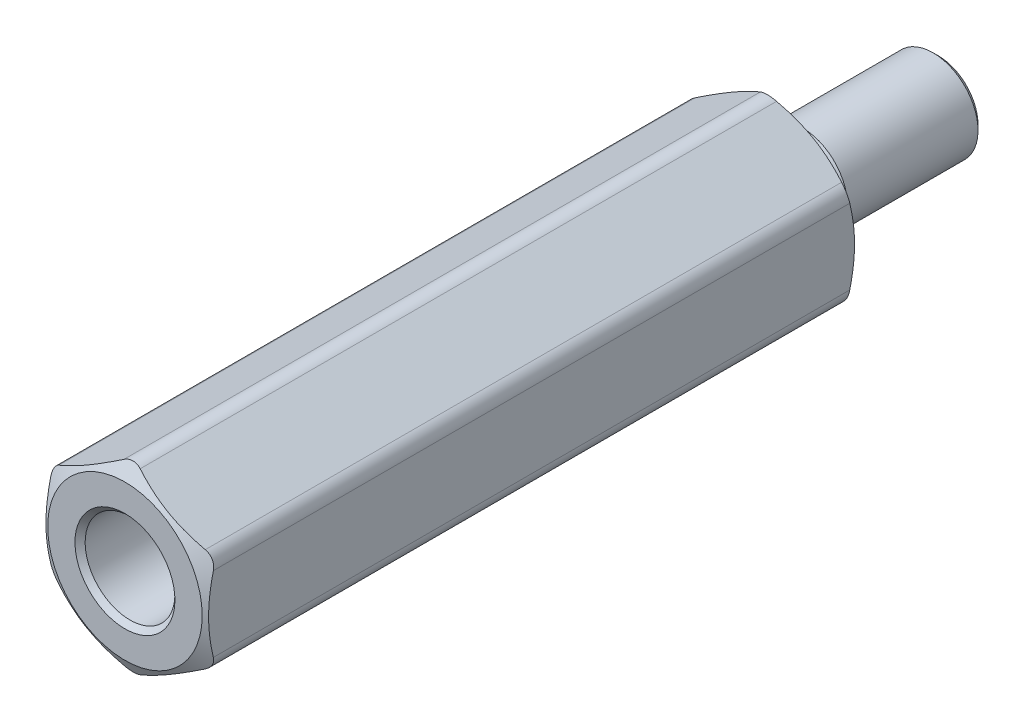
from build123d import *

# Parameters (mm, degrees)
SKETCH4_R           = 2.4638
BOSS_EXTRUDE1_DEPTH = 25.4
SKETCH5_OUTSIDE_W   = 129.714
SKETCH5_OUTSIDE_H   = 130.696
SKETCH5_OUTSIDE_R   = 3.01625
CUT_EXTRUDE1_DEPTH  = 33.11828075
CUT_EXTRUDE1_DRAFT  = -60
SKETCH6_OUTSIDE_W   = 108.032
SKETCH6_OUTSIDE_H   = 109.014
SKETCH6_OUTSIDE_R   = 3.01625
CUT_EXTRUDE2_DEPTH  = 26.858875813
CUT_EXTRUDE2_DRAFT  = -60
FILLET1_R           = 0.635


with BuildPart() as part:
    # Sketch3 → Revolve1 (revolve)
    with BuildSketch(Plane(origin=(0, 0, 0), x_dir=(0, 0, -1), z_dir=(1, 0, 0))):
        with BuildLine():
            Line((-15.875, 1.5541625), (-15.875, 0))
            Line((-15.875, 0), (6.35, 0))
            Line((6.35, 0), (6.35, 1.5541625))
            Line((6.35, 1.5541625), (6.1515625, 1.7526))
            Line((6.1515625, 1.7526), (1.05965625, 1.7526))
            Line((1.05965625, 1.7526), (0.762, 1.237044252))
            Line((0.762, 1.237044252), (0.1984375, 1.237044252))
            ThreePointArc((0.1984375, 1.237044252), (0.058120998, 1.29516525), (0, 1.435481752))
            Line((0, 1.435481752), (0, 3.175))
            Line((0, 3.175), (-25.4, 3.175))
            Line((-25.4, 3.175), (-25.4, 1.9510375))
            Line((-25.4, 1.9510375), (-25.2015625, 1.7526))
            Line((-25.2015625, 1.7526), (-16.0734375, 1.7526))
            Line((-16.0734375, 1.7526), (-15.875, 1.5541625))
        make_face()
    revolve(axis=Axis((0, 0, -6.35), (0, 0, 1)))

    # Sketch4 → Boss-Extrude1 (add)
    with BuildSketch(Plane.XY.offset(25.4)):
        Polygon((-3.175, 1.833087105), (-3.175, -1.833087105), (0, -3.666174209), (3.175, -1.833087105), (3.175, 1.833087105), (0, 3.666174209), align=None)
        Circle(SKETCH4_R, mode=Mode.SUBTRACT)
    extrude(amount=-BOSS_EXTRUDE1_DEPTH)


with BuildPart() as cut_extrude1_tool:
    # Sketch5 outside → Cut-Extrude1 (with draft: the straight prism first)
    with BuildSketch(Plane.XY.offset(25.4)):
        Rectangle(SKETCH5_OUTSIDE_W, SKETCH5_OUTSIDE_H)
        Circle(SKETCH5_OUTSIDE_R, mode=Mode.SUBTRACT)
    extrude(amount=-CUT_EXTRUDE1_DEPTH)
    # Cut-Extrude1: the draft: its side faces are tilted about the plane it starts from
    cut_extrude1_sides = [cut_extrude1_tool.faces().sort_by_distance(p)[0] for p in [
        (0, -65.348, 8.840859625),
        (64.857, 0, 8.840859625),
        (0, 65.348, 8.840859625),
        (-64.857, 0, 8.840859625),
        (-3.01625, 0, 8.840859625),
    ]]
    draft(cut_extrude1_sides, Plane.XY.offset(25.4), CUT_EXTRUDE1_DRAFT)


with BuildPart() as part_1:
    add(part.part)

    # Cut-Extrude1: cut by cut_extrude1_tool
    add(cut_extrude1_tool.part, mode=Mode.SUBTRACT)


with BuildPart() as cut_extrude2_tool:
    # Sketch6 outside → Cut-Extrude2 (with draft: the straight prism first)
    with BuildSketch(Plane(origin=(0, 0, 0), x_dir=(-1, 0, 0), z_dir=(0, 0, -1))):
        Rectangle(SKETCH6_OUTSIDE_W, SKETCH6_OUTSIDE_H)
        Circle(SKETCH6_OUTSIDE_R, mode=Mode.SUBTRACT)
    extrude(amount=-CUT_EXTRUDE2_DEPTH)
    # Cut-Extrude2: the draft: its side faces are tilted about the plane it starts from
    cut_extrude2_sides = [cut_extrude2_tool.faces().sort_by_distance(p)[0] for p in [
        (0, -54.507, 13.429437907),
        (-54.016, 0, 13.429437907),
        (0, 54.507, 13.429437907),
        (54.016, 0, 13.429437907),
        (3.01625, 0, 13.429437907),
    ]]
    draft(cut_extrude2_sides, Plane(origin=(0, 0, 0), x_dir=(-1, 0, 0), z_dir=(0, 0, -1)), CUT_EXTRUDE2_DRAFT)


with BuildPart() as part_2:
    add(part_1.part)

    # Cut-Extrude2: cut by cut_extrude2_tool
    add(cut_extrude2_tool.part, mode=Mode.SUBTRACT)

    # Fillet1
    fillet1_edges = [part_2.edges().sort_by_distance(p)[0] for p in [
        (0, 3.666174209, 12.7),
        (-3.175, -1.833087105, 12.7),
        (0, -3.666174209, 12.7),
        (3.175, -1.833087105, 12.7),
        (3.175, 1.833087105, 12.7),
        (-3.175, 1.833087105, 12.7),
    ]]
    fillet(fillet1_edges, radius=FILLET1_R)


solid = part_2.part
